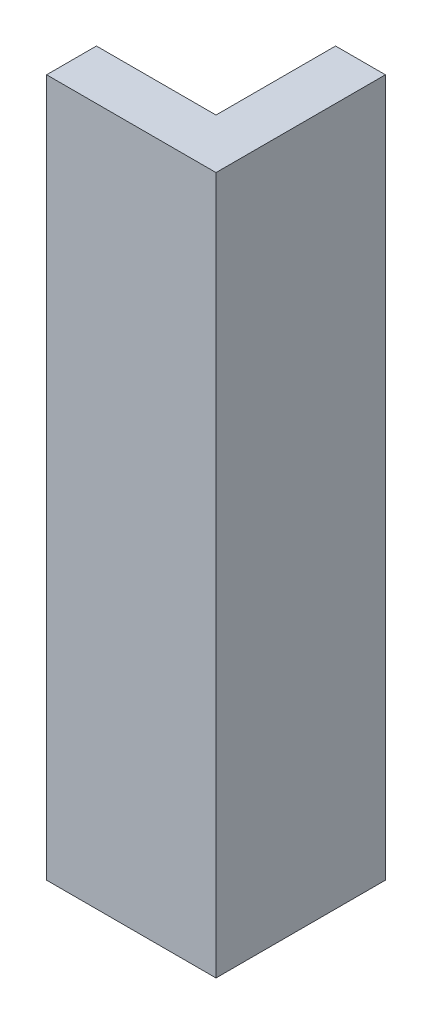
from build123d import *

# Parameters (mm, degrees)
SKETCH_1_W          = 17
SKETCH_1_H          = 17
EXTRUDE_1_DEPTH     = 70
SKETCH_2_W          = 12
SKETCH_2_H          = 12
CUT_EXTRUDE_1_DEPTH = 66
SKETCH_3_R          = 1.5
CUT_EXTRUDE_2_DEPTH = 8


with BuildPart() as part:
    # 草图1 → 凸台-拉伸1 (new body)
    with BuildSketch(Plane(origin=(0, 0, 0), x_dir=(1, 0, 0), z_dir=(0, 1, 0))):
        with Locations((8.5, -8.5)):
            Rectangle(SKETCH_1_W, SKETCH_1_H)
    extrude(amount=EXTRUDE_1_DEPTH)

    # 草图2 → 切除-拉伸1 (cut)
    with BuildSketch(Plane(origin=(0, 70, 0), x_dir=(1, 0, 0), z_dir=(0, 1, 0))):
        with Locations((6, -6)):
            Rectangle(SKETCH_2_W, SKETCH_2_H)
    extrude(amount=-CUT_EXTRUDE_1_DEPTH, mode=Mode.SUBTRACT)

    # 草图3 → 切除-拉伸2 (cut)
    with BuildSketch(Plane(origin=(0, 0, 0), x_dir=(-1, 0, 0), z_dir=(0, -1, 0))):
        with Locations(Location((-9.574531369, -2.425468631, 0), (0, 0, 90))):
            Circle(SKETCH_3_R)
        with Locations(Location((-2.425468631, -2.425468631, 0), (0, 0, 90))):
            Circle(SKETCH_3_R)
        with Locations(Location((-9.574531369, -9.574531369, 0), (0, 0, 90))):
            Circle(SKETCH_3_R)
        with Locations(Location((-2.425468631, -9.574531369, 0), (0, 0, 90))):
            Circle(SKETCH_3_R)
    extrude(amount=-CUT_EXTRUDE_2_DEPTH, mode=Mode.SUBTRACT)


solid = part.part
